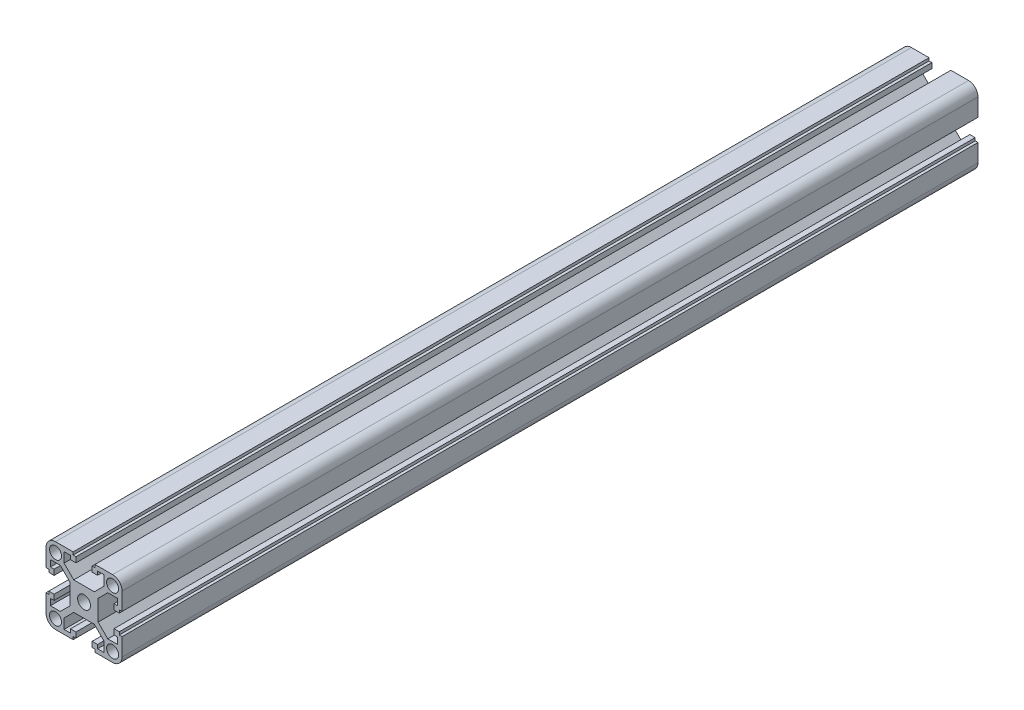
from build123d import *

# Parameters (mm, degrees)
SKETCH_1_R      = 3.4
SKETCH_1_R_2    = 3.15
EXTRUDE_1_DEPTH = 225


with BuildPart() as part:
    # Эскиз1 → Бобышка-Вытянуть1 (new, symmetric)
    with BuildSketch(Plane.XY):
        with BuildLine():
            Line((-15, 20), (-5.727351849, 20))
            Line((-5.727351849, 20), (-5.727351849, 18.530416438))
            Line((-5.727351849, 18.530416438), (-4.25, 18.530416438))
            Line((-4.25, 18.530416438), (-4.25, 15.732027397))
            Line((-4.25, 15.732027397), (-7.111831817, 15.732027397))
            Line((-7.111831817, 15.732027397), (-7.111831817, 17.7))
            Line((-7.111831817, 17.7), (-10.5, 17.7))
            Line((-10.5, 17.7), (-10.5, 12.479898987))
            Line((-10.5, 12.479898987), (-5.420101013, 7.4))
            Line((-5.420101013, 7.4), (5.420101013, 7.4))
            Line((5.420101013, 7.4), (10.5, 12.479898987))
            Line((10.5, 12.479898987), (10.5, 17.7))
            Line((10.5, 17.7), (7.111831817, 17.7))
            Line((7.111831817, 17.7), (7.111831817, 15.732027397))
            Line((7.111831817, 15.732027397), (4.25, 15.732027397))
            Line((4.25, 15.732027397), (4.25, 18.530416438))
            Line((4.25, 18.530416438), (5.727351849, 18.530416438))
            Line((5.727351849, 18.530416438), (5.727351849, 20))
            Line((5.727351849, 20), (15, 20))
            ThreePointArc((15, 20), (18.535533906, 18.535533906), (20, 15))
            Line((20, 15), (20, 5.727351849))
            Line((20, 5.727351849), (18.530416438, 5.727351849))
            Line((18.530416438, 5.727351849), (18.530416438, 4.25))
            Line((18.530416438, 4.25), (15.732027397, 4.25))
            Line((15.732027397, 4.25), (15.732027397, 7.111831817))
            Line((15.732027397, 7.111831817), (17.7, 7.111831817))
            Line((17.7, 7.111831817), (17.7, 10.5))
            Line((17.7, 10.5), (12.479898987, 10.5))
            Line((12.479898987, 10.5), (7.4, 5.420101013))
            Line((7.4, 5.420101013), (7.4, -5.420101013))
            Line((7.4, -5.420101013), (12.479898987, -10.5))
            Line((12.479898987, -10.5), (17.7, -10.5))
            Line((17.7, -10.5), (17.7, -7.111831817))
            Line((17.7, -7.111831817), (15.732027397, -7.111831817))
            Line((15.732027397, -7.111831817), (15.732027397, -4.25))
            Line((15.732027397, -4.25), (18.530416438, -4.25))
            Line((18.530416438, -4.25), (18.530416438, -5.727351849))
            Line((18.530416438, -5.727351849), (20, -5.727351849))
            Line((20, -5.727351849), (20, -15))
            ThreePointArc((20, -15), (18.535533906, -18.535533906), (15, -20))
            Line((15, -20), (5.727351849, -20))
            Line((5.727351849, -20), (5.727351849, -18.530416438))
            Line((5.727351849, -18.530416438), (4.25, -18.530416438))
            Line((4.25, -18.530416438), (4.25, -15.732027397))
            Line((4.25, -15.732027397), (7.111831817, -15.732027397))
            Line((7.111831817, -15.732027397), (7.111831817, -17.7))
            Line((7.111831817, -17.7), (10.5, -17.7))
            Line((10.5, -17.7), (10.5, -12.479898987))
            Line((10.5, -12.479898987), (5.420101013, -7.4))
            Line((5.420101013, -7.4), (-5.420101013, -7.4))
            Line((-5.420101013, -7.4), (-10.5, -12.479898987))
            Line((-10.5, -12.479898987), (-10.5, -17.7))
            Line((-10.5, -17.7), (-7.111831817, -17.7))
            Line((-7.111831817, -17.7), (-7.111831817, -15.732027397))
            Line((-7.111831817, -15.732027397), (-4.25, -15.732027397))
            Line((-4.25, -15.732027397), (-4.25, -18.530416438))
            Line((-4.25, -18.530416438), (-5.727351849, -18.530416438))
            Line((-5.727351849, -18.530416438), (-5.727351849, -20))
            Line((-5.727351849, -20), (-15, -20))
            ThreePointArc((-15, -20), (-18.535533906, -18.535533906), (-20, -15))
            Line((-20, -15), (-20, -5.727351849))
            Line((-20, -5.727351849), (-18.530416438, -5.727351849))
            Line((-18.530416438, -5.727351849), (-18.530416438, -4.25))
            Line((-18.530416438, -4.25), (-15.732027397, -4.25))
            Line((-15.732027397, -4.25), (-15.732027397, -7.111831817))
            Line((-15.732027397, -7.111831817), (-17.7, -7.111831817))
            Line((-17.7, -7.111831817), (-17.7, -10.5))
            Line((-17.7, -10.5), (-12.479898987, -10.5))
            Line((-12.479898987, -10.5), (-7.4, -5.420101013))
            Line((-7.4, -5.420101013), (-7.4, 5.420101013))
            Line((-7.4, 5.420101013), (-12.479898987, 10.5))
            Line((-12.479898987, 10.5), (-17.7, 10.5))
            Line((-17.7, 10.5), (-17.7, 7.111831817))
            Line((-17.7, 7.111831817), (-15.732027397, 7.111831817))
            Line((-15.732027397, 7.111831817), (-15.732027397, 4.25))
            Line((-15.732027397, 4.25), (-18.530416438, 4.25))
            Line((-18.530416438, 4.25), (-18.530416438, 5.727351849))
            Line((-18.530416438, 5.727351849), (-20, 5.727351849))
            Line((-20, 5.727351849), (-20, 15))
            ThreePointArc((-20, 15), (-18.535533906, 18.535533906), (-15, 20))
        make_face()
        Circle(SKETCH_1_R, mode=Mode.SUBTRACT)
        with Locations((-15, 15)):
            Circle(SKETCH_1_R_2, mode=Mode.SUBTRACT)
        with Locations((15, 15)):
            Circle(SKETCH_1_R_2, mode=Mode.SUBTRACT)
        with Locations((15, -15)):
            Circle(SKETCH_1_R_2, mode=Mode.SUBTRACT)
        with Locations((-15, -15)):
            Circle(SKETCH_1_R_2, mode=Mode.SUBTRACT)
    extrude(amount=EXTRUDE_1_DEPTH, both=True)


solid = part.part
